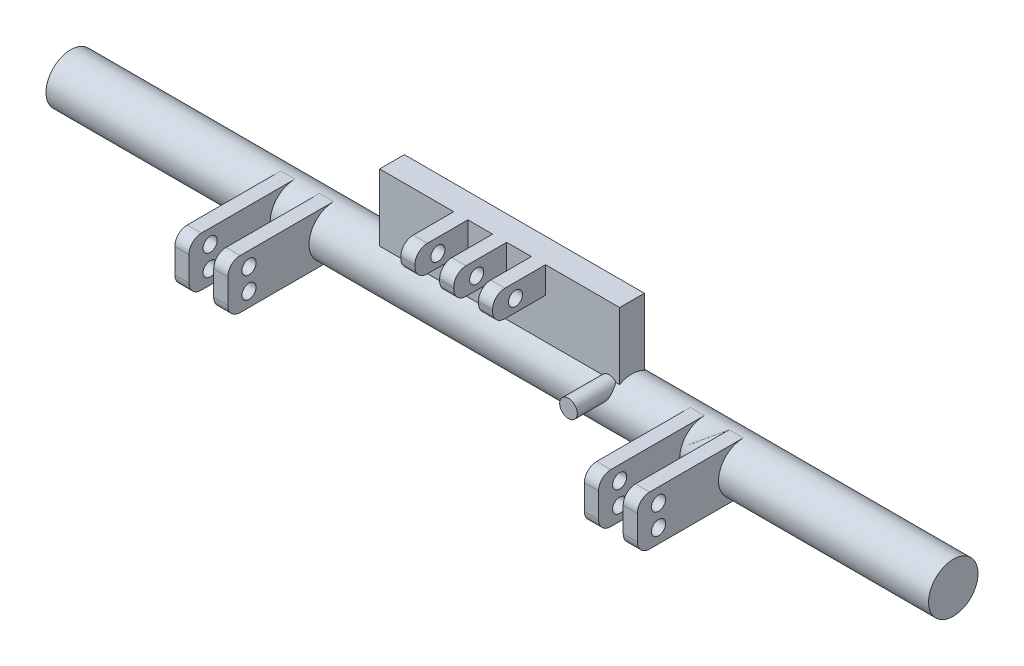
from build123d import *

# Parameters (mm, degrees)
SKETCH1_W               = 250
SKETCH1_H               = 7
SKETCH2_W               = 68
SKETCH2_H               = 7
BOSS_EXTRUDE1_DEPTH     = 25
SKETCH3_W               = 4
SKETCH3_H               = 7.5
BOSS_EXTRUDE2_DEPTH     = 15
FILLET1_R               = 3.5
SKETCH5_R               = 2.5
SKETCH5_W               = 4
SKETCH5_H               = 14
BOSS_EXTRUDE3_DEPTH     = 30
FILLET2_R               = 3.5
CUT_EXTRUDE1_DEPTH      = 195.461435879
CUT_EXTRUDE1_DEPTH_BACK = 195.461435879
SKETCH6_R               = 2
SKETCH4_R               = 2
CUT_EXTRUDE2_DEPTH      = 144.418966785
CUT_EXTRUDE3_START      = -15
SKETCH7_R               = 2.5
CUT_EXTRUDE3_DEPTH      = 15


with BuildPart() as part:
    # Sketch1 → Revolve-Thin1 (revolve)
    with BuildSketch(Plane.XY, mode=Mode.PRIVATE) as revolve_thin1_sk:
        with Locations((0, 3.5)):
            Rectangle(SKETCH1_W, SKETCH1_H)
    revolve(revolve_thin1_sk.sketch.rotate(Axis((-125, 0, 0), (1, 0, 0)), 180), axis=Axis((-125, 0, 0), (1, 0, 0)))

    # Sketch2 → Boss-Extrude1 (add)
    with BuildSketch(Plane(origin=(0, 0, 0), x_dir=(1, 0, 0), z_dir=(0, 1, 0))):
        Rectangle(SKETCH2_W, SKETCH2_H)
    extrude(amount=BOSS_EXTRUDE1_DEPTH)

    # Sketch3 → Boss-Extrude2 (add)
    with BuildSketch(Plane.XY.offset(3.5)):
        with Locations((-11, 21.25)):
            Rectangle(SKETCH3_W, SKETCH3_H)
        with Locations((0, 21.25)):
            Rectangle(SKETCH3_W, SKETCH3_H)
        with Locations((11, 21.25)):
            Rectangle(SKETCH3_W, SKETCH3_H)
    extrude(amount=BOSS_EXTRUDE2_DEPTH)

    # Fillet1
    fillet1_edges = [part.edges().sort_by_distance(p)[0] for p in [
        (-11, 17.5, 18.5),
        (-11, 25, 18.5),
        (0, 17.5, 18.5),
        (0, 25, 18.5),
        (11, 17.5, 18.5),
        (11, 25, 18.5),
    ]]
    fillet(fillet1_edges, radius=FILLET1_R)

    # Sketch5 → Boss-Extrude3 (add)
    with BuildSketch(Plane.XY):
        with Locations(Location((31, 4.5, 0), (0, 0, 141.327270593))):
            Circle(SKETCH5_R)
        with Locations((-52.5, 0)):
            Rectangle(SKETCH5_W, SKETCH5_H)
        with Locations((-63.5, 0)):
            Rectangle(SKETCH5_W, SKETCH5_H)
        with Locations((63.5, 0)):
            Rectangle(SKETCH5_W, SKETCH5_H)
        with Locations((52.5, 0)):
            Rectangle(SKETCH5_W, SKETCH5_H)
    extrude(amount=BOSS_EXTRUDE3_DEPTH)

    # Fillet2
    fillet2_edges = [part.edges().sort_by_distance(p)[0] for p in [
        (-63.5, 7, 30),
        (-63.5, -7, 30),
        (63.5, 7, 30),
        (63.5, -7, 30),
        (52.5, 7, 30),
        (52.5, -7, 30),
        (-52.5, -7, 30),
        (-52.5, 7, 30),
    ]]
    fillet(fillet2_edges, radius=FILLET2_R)

    # Sketch6 → Cut-Extrude1 (cut, two sides: drawn at the far end of the back side and taken through both)
    with BuildSketch(Plane.ZY.offset(65.5).offset(-CUT_EXTRUDE1_DEPTH_BACK)):
        with Locations(Location((24, 3, 0), (0, 0, 180))):
            Circle(SKETCH6_R)
        with Locations(Location((24, -3, 0), (0, 0, 180))):
            Circle(SKETCH6_R)
    extrude(amount=CUT_EXTRUDE1_DEPTH + CUT_EXTRUDE1_DEPTH_BACK, mode=Mode.SUBTRACT)

    # Sketch4 → Cut-Extrude2 (cut, through all)
    with BuildSketch(Plane.ZY.offset(13)):
        with Locations(Location((12, 21, 0), (0, 0, 270))):
            Circle(SKETCH4_R)
    extrude(amount=-CUT_EXTRUDE2_DEPTH, mode=Mode.SUBTRACT)

    # Sketch7 → Cut-Extrude3 (cut)
    with BuildSketch(Plane.XY.offset(30).offset(CUT_EXTRUDE3_START)):
        with Locations(Location((31, 4.5, 0), (0, 0, 141.327270593))):
            Circle(SKETCH7_R)
    extrude(amount=CUT_EXTRUDE3_DEPTH, mode=Mode.SUBTRACT)


solid = part.part
